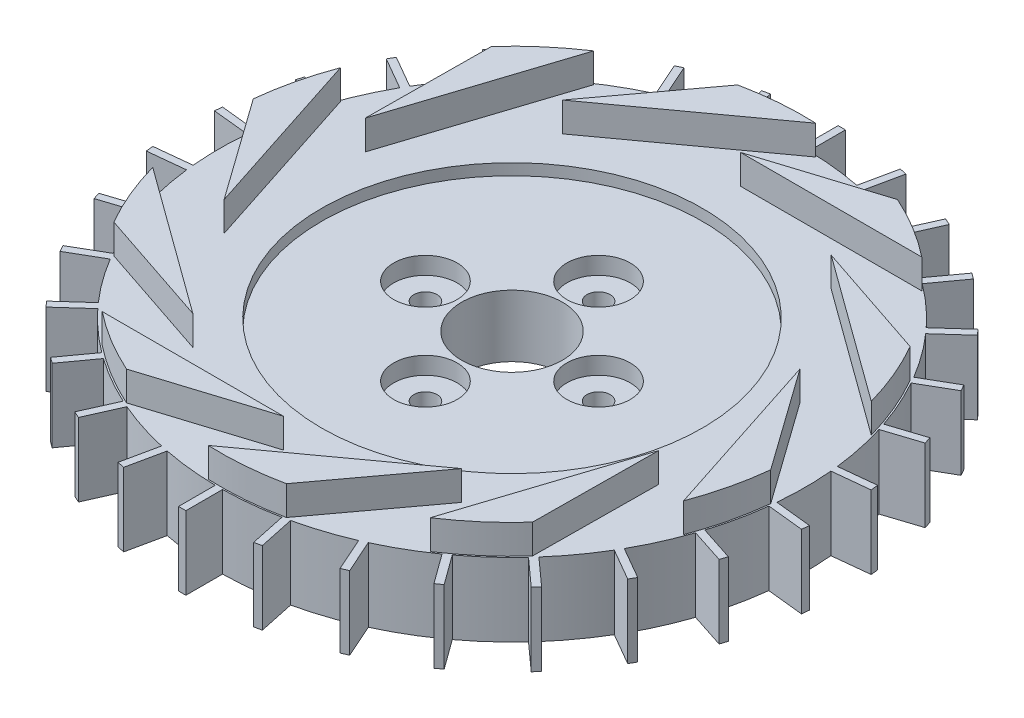
from build123d import *

# Parameters (mm, degrees)
BOSS_EXTRUDE1_DEPTH = 5.08
CIRPATTERN1_COUNT   = 10
BOSS_EXTRUDE2_START = -0.254
SKETCH3_W           = 1.27
SKETCH3_H           = 12.7
BOSS_EXTRUDE2_DEPTH = 7.874
CIRPATTERN16_COUNT  = 30
CUT_EXTRUDE1_REACH  = 83.36
SKETCH4_R           = 8.73125
SKETCH5_R           = 44.45
CUT_EXTRUDE2_DEPTH  = 6.35
SKETCH6_R           = 19.05
SKETCH6_R_2         = 8.73125
BOSS_EXTRUDE3_DEPTH = 6.35
CUT_EXTRUDE3_REACH  = 83.36
SKETCH9_R           = 2
CIRPATTERN17_COUNT  = 4
SKETCH11_R          = 5.5
CUT_EXTRUDE5_DEPTH  = 3


with BuildPart() as part:
    # Sketch1 → Revolve1 (revolve)
    with BuildSketch(Plane(origin=(0, 0, 0), x_dir=(0, 0, -1), z_dir=(1, 0, 0))):
        Polygon((0, -3.588552689), (-50.8, -3.588552689), (-50.8, 9.111447311), (-33.000061, 9.111447311), (-33.000061, 7.151456311), (0, 7.151456311), align=None)
    revolve(axis=Axis((0, 26.263106796, 0), (0, -1, 0)))

    # Sketch2 → Boss-Extrude1 (add)
    with BuildSketch(Plane(origin=(0, 9.111447311, 0), x_dir=(1, 0, 0), z_dir=(0, 1, 0))):
        with BuildLine():
            Line((0, 39.6000732), (20.6819818, 46.121077013))
            ThreePointArc((20.6819818, 46.121077013), (26.2504154, 43.195066933), (31.412295659, 39.6000732))
            Line((31.412295659, 39.6000732), (0, 39.6000732))
        make_face()
    boss_extrude1 = extrude(amount=BOSS_EXTRUDE1_DEPTH)

    # CirPattern1: Boss-Extrude1 ×10 about axis
    cirpattern1_axis = Axis((0, 0, 0), (0, 1, 0))
    for i in range(1, CIRPATTERN1_COUNT):
        add(boss_extrude1.rotate(cirpattern1_axis, i * 360 / CIRPATTERN1_COUNT))

    # Sketch3 → Boss-Extrude2 (add)
    with BuildSketch(Plane.XY.offset(49.53).offset(BOSS_EXTRUDE2_START)):
        with Locations((0, 2.761447311)):
            Rectangle(SKETCH3_W, SKETCH3_H)
    boss_extrude2 = extrude(amount=BOSS_EXTRUDE2_DEPTH)

    # CirPattern16: Boss-Extrude2 ×30 about axis
    cirpattern16_axis = Axis((0, 0, 0), (0, 1, 0))
    for i in range(1, CIRPATTERN16_COUNT):
        add(boss_extrude2.rotate(cirpattern16_axis, i * 360 / CIRPATTERN16_COUNT))

    # Sketch4 → Cut-Extrude1 (cut, up to next)
    with BuildSketch(Plane(origin=(0, 7.151456311, 0), x_dir=(1, 0, 0), z_dir=(0, 1, 0)), mode=Mode.PRIVATE) as cut_extrude1_sk1:
        with Locations(Location((0, 0, 0), (0, 0, 270))):
            Circle(SKETCH4_R)
    cut_extrude1_tool1 = extrude(cut_extrude1_sk1.sketch, amount=-CUT_EXTRUDE1_REACH, mode=Mode.PRIVATE) & part.part
    add(cut_extrude1_tool1.solids().sort_by_distance((0, 7.151456, 0))[0], mode=Mode.SUBTRACT)

    # Sketch5 → Cut-Extrude2 (cut)
    with BuildSketch(Plane(origin=(0, -3.588552689, 0), x_dir=(-1, 0, 0), z_dir=(0, -1, 0))):
        with Locations(Location((0, 0, 0), (0, 0, 90))):
            Circle(SKETCH5_R)
    extrude(amount=-CUT_EXTRUDE2_DEPTH, mode=Mode.SUBTRACT)

    # Sketch6 → Boss-Extrude3 (add)
    with BuildSketch(Plane.XZ.offset(-2.761447311)):
        with Locations(Location((0, 0, 0), (0, 0, 90))):
            Circle(SKETCH6_R)
        with Locations(Location((0, 0, 0), (0, 0, 90))):
            Circle(SKETCH6_R_2, mode=Mode.SUBTRACT)
    extrude(amount=BOSS_EXTRUDE3_DEPTH)

    # Sketch9 → Cut-Extrude3 (cut, up to next)
    with BuildSketch(Plane(origin=(0, 7.151456311, 0), x_dir=(1, 0, 0), z_dir=(0, 1, 0)), mode=Mode.PRIVATE) as cut_extrude3_sk1:
        with Locations(Location((0, 14.999999972, 0), (0, 0, 270))):
            Circle(SKETCH9_R)
    cut_extrude3_tool1 = extrude(cut_extrude3_sk1.sketch, amount=-CUT_EXTRUDE3_REACH, mode=Mode.PRIVATE) & part.part
    cut_extrude3 = cut_extrude3_tool1.solids().sort_by_distance((0, 7.151456, -15))[0]
    add(cut_extrude3, mode=Mode.SUBTRACT)

    # CirPattern17: Cut-Extrude3 ×4 about axis
    cirpattern17_axis = Axis((0, 0, 0), (0, 1, 0))
    for i in range(1, CIRPATTERN17_COUNT):
        add(cut_extrude3.rotate(cirpattern17_axis, i * 360 / CIRPATTERN17_COUNT), mode=Mode.SUBTRACT)

    # Sketch11 → Cut-Extrude5 (cut)
    with BuildSketch(Plane(origin=(0, 7.151456311, 0), x_dir=(1, 0, 0), z_dir=(0, 1, 0))):
        with Locations(Location((0, -14.999999972, 0), (0, 0, 270))):
            Circle(SKETCH11_R)
        with Locations(Location((-14.999999972, 0, 0), (0, 0, 270))):
            Circle(SKETCH11_R)
        with Locations(Location((0, 14.999999972, 0), (0, 0, 270))):
            Circle(SKETCH11_R)
        with Locations(Location((14.999999972, 0, 0), (0, 0, 270))):
            Circle(SKETCH11_R)
    extrude(amount=-CUT_EXTRUDE5_DEPTH, mode=Mode.SUBTRACT)


solid = part.part
